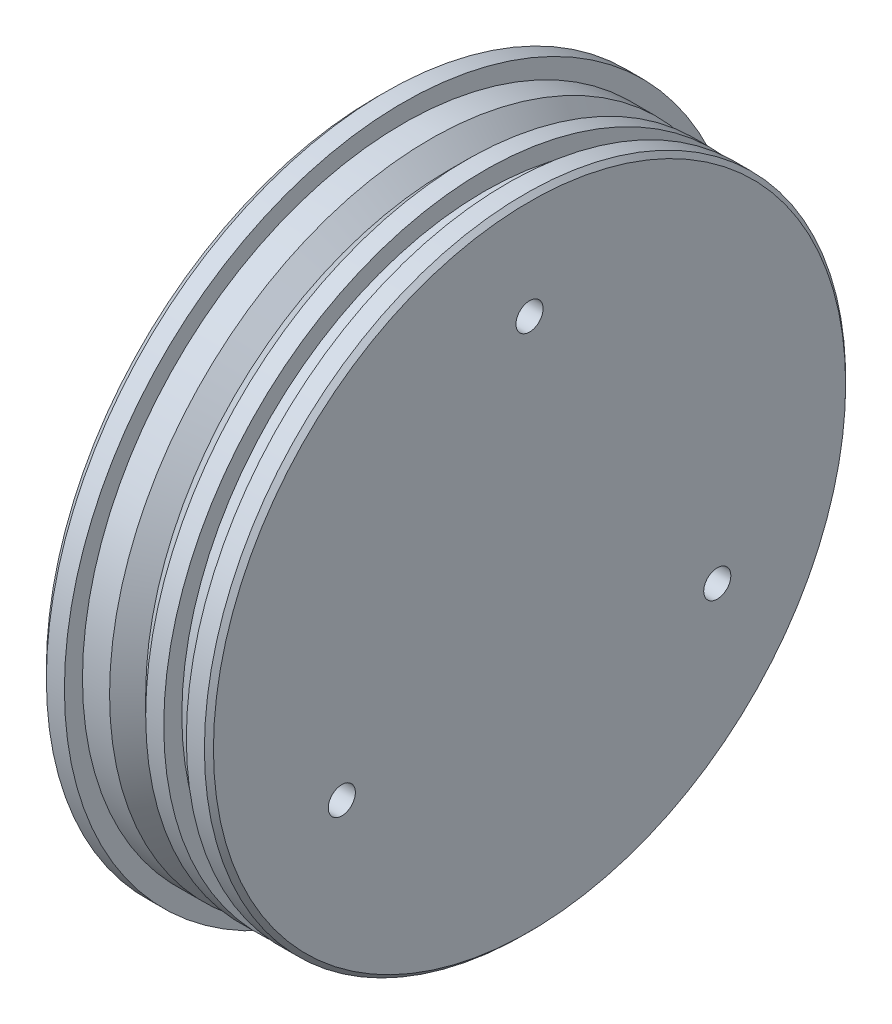
from build123d import *

# Parameters (mm, degrees)
SKETCH_2_R          = 1.5
CUT_EXTRUDE_1_DEPTH = 10


with BuildPart() as part:
    # Эскиз1 → Повернуть1 (revolve)
    with BuildSketch(Plane.XY, mode=Mode.PRIVATE) as revolve_1_sk:
        Polygon((-17, 0), (-17, 36.5), (-16, 37.5), (-14, 37.5), (-14, 35.5), (-11, 35.5), (-9, 33.5), (-7, 35.5), (-5, 35.5), (-5, 33.5), (-2.5, 33.5), (-2.5, 35.5), (-0.5, 35.5), (0, 35), (0, 0), align=None)
    revolve(revolve_1_sk.sketch.rotate(Axis((0, 0, 0), (1, 0, 0)), 90), axis=Axis((0, 0, 0), (1, 0, 0)))

    # Эскиз2 → Вырез-Вытянуть1 (cut)
    with BuildSketch(Plane(origin=(0, 0, 0), x_dir=(0, 0, -1), z_dir=(1, 0, 0))):
        with Locations((20.784609691, -12)):
            Circle(SKETCH_2_R)
        with Locations((0, 24)):
            Circle(SKETCH_2_R)
        with Locations((-20.784609691, -12)):
            Circle(SKETCH_2_R)
    extrude(amount=-CUT_EXTRUDE_1_DEPTH, mode=Mode.SUBTRACT)


solid = part.part
